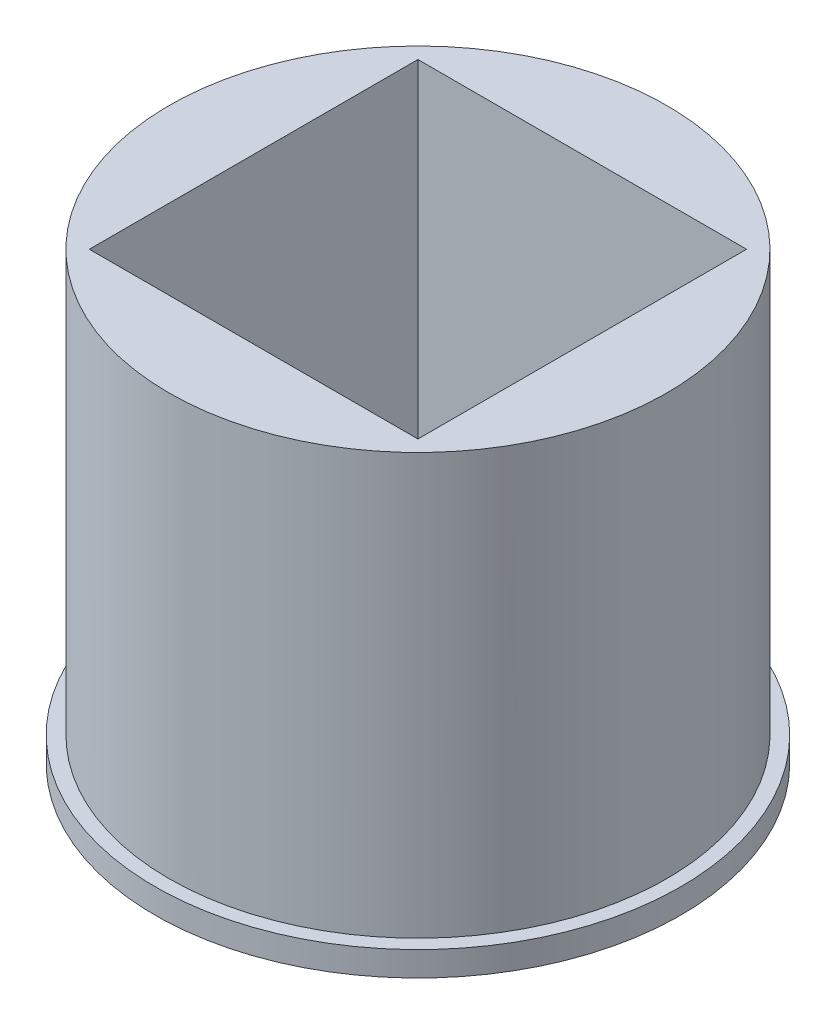
from build123d import *

# Parameters (mm, degrees)
SKETCH1_R           = 15
SKETCH1_W           = 20
SKETCH1_H           = 20
BOSS_EXTRUDE1_DEPTH = 27.1
SKETCH2_R           = 16
BOSS_EXTRUDE2_DEPTH = 1.5
BOSS_EXTRUDE4_START = -27.1
SKETCH3_R           = 15.15
SKETCH3_R_2         = 15
SKETCH3_W           = 20
SKETCH3_H           = 20
BOSS_EXTRUDE4_DEPTH = 27.1
CUT_EXTRUDE1_START  = -1.5
SKETCH4_R           = 15.15
CUT_EXTRUDE1_DEPTH  = 1.5


with BuildPart() as part:
    # Sketch1 → Boss-Extrude1 (new body)
    with BuildSketch(Plane(origin=(0, 0, 0), x_dir=(1, 0, 0), z_dir=(0, 1, 0))):
        with Locations(Location((0, 0, 0), (0, 0, 90))):
            Circle(SKETCH1_R)
        Rectangle(SKETCH1_W, SKETCH1_H, mode=Mode.SUBTRACT)
    extrude(amount=BOSS_EXTRUDE1_DEPTH)

    # Sketch2 → Boss-Extrude2 (add)
    with BuildSketch(Plane.XZ):
        with Locations(Location((0, 0, 0), (0, 0, 270))):
            Circle(SKETCH2_R)
    extrude(amount=BOSS_EXTRUDE2_DEPTH)

    # Sketch3 → Boss-Extrude4 (add)
    # profile 1 of 2: a face of its own
    with BuildSketch(Plane(origin=(0, 27.1, 0), x_dir=(1, 0, 0), z_dir=(0, 1, 0)).offset(BOSS_EXTRUDE4_START)):
        with Locations(Location((0, 0, 0), (0, 0, 270))):
            Circle(SKETCH3_R)
        Circle(SKETCH3_R_2, mode=Mode.SUBTRACT)
    # profile 2 of 2: a face of its own
    with BuildSketch(Plane(origin=(0, 27.1, 0), x_dir=(1, 0, 0), z_dir=(0, 1, 0)).offset(BOSS_EXTRUDE4_START)):
        Circle(SKETCH3_R_2)
        Rectangle(SKETCH3_W, SKETCH3_H, mode=Mode.SUBTRACT)
    extrude(amount=BOSS_EXTRUDE4_DEPTH)

    # Sketch4 → Cut-Extrude1 (cut)
    with BuildSketch(Plane(origin=(0, 27.1, 0), x_dir=(1, 0, 0), z_dir=(0, 1, 0)).offset(CUT_EXTRUDE1_START)):
        with Locations(Location((0, 0, 0), (0, 0, 270))):
            Circle(SKETCH4_R)
    extrude(amount=CUT_EXTRUDE1_DEPTH, mode=Mode.SUBTRACT)


solid = part.part
